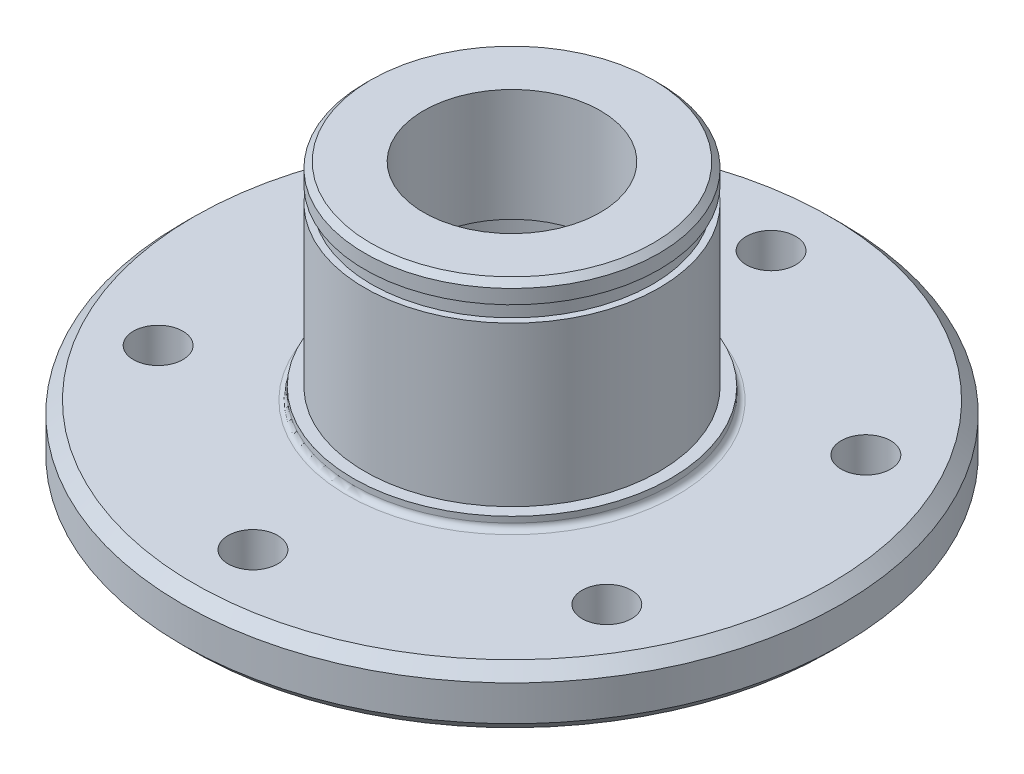
from build123d import *

# Parameters (mm, degrees)
HOLE_WIZARD_M5_1_D    = 4.2
M20X1_5_1_D           = 15
M20X1_5_1_CBORE_D     = 20
M20X1_5_1_CBORE_DEPTH = 13
CHAMFER_1_SIZE        = 0.5
CHAMFER_2_SIZE        = 1
FILLET_1_R            = 0.5


with BuildPart() as part:
    # 草图1 → 旋转1 (revolve)
    with BuildSketch(Plane(origin=(0, 0, 0), x_dir=(-1, 0, 0), z_dir=(0, 0, -1)), mode=Mode.PRIVATE) as revolve_1_sk:
        Polygon((-28, 0), (0, 0), (0, 22.55), (-12.5, 22.55), (-12.5, 20.85), (-11.95, 20.85), (-11.95, 19.5), (-12.5, 19.5), (-12.5, 6), (-13.5, 6), (-13.5, 5), (-28, 5), align=None)
    revolve(revolve_1_sk.sketch.rotate(Axis((0, 0, 0), (0, 1, 0)), 180), axis=Axis((0, 0, 0), (0, 1, 0)))

    # M5 螺纹孔1 (through all)
    with Locations(Plane(origin=(0, 0, 0), x_dir=(-1, 0, 0), z_dir=(0, -1, 0))):
        with Locations((0, -22), (-19.052558883, -11), (-19.052558883, 11), (0, 22), (19.052558883, 11), (19.052558883, -11)):
            Hole(HOLE_WIZARD_M5_1_D / 2)

    # M20x1.5 螺纹孔1 (through all)
    with Locations(Plane(origin=(0, 0, 0), x_dir=(-1, 0, 0), z_dir=(0, -1, 0))):
        with Locations((0, 0)):
            CounterBoreHole(M20X1_5_1_D / 2, M20X1_5_1_CBORE_D / 2, M20X1_5_1_CBORE_DEPTH)

    # 倒角1
    chamfer_1_edges = [part.edges().sort_by_distance(p)[0] for p in [
        (12.5, 22.55, 0),
    ]]
    chamfer(chamfer_1_edges, length=CHAMFER_1_SIZE)

    # 倒角2
    chamfer_2_edges = [part.edges().sort_by_distance(p)[0] for p in [
        (28, 0, 0),
        (10, 0, 0),
        (28, 5, 0),
    ]]
    chamfer(chamfer_2_edges, length=CHAMFER_2_SIZE)

    # 圆角1
    fillet_1_edges = [part.edges().sort_by_distance(p)[0] for p in [
        (13.5, 5, 0),
    ]]
    fillet(fillet_1_edges, radius=FILLET_1_R)


solid = part.part
